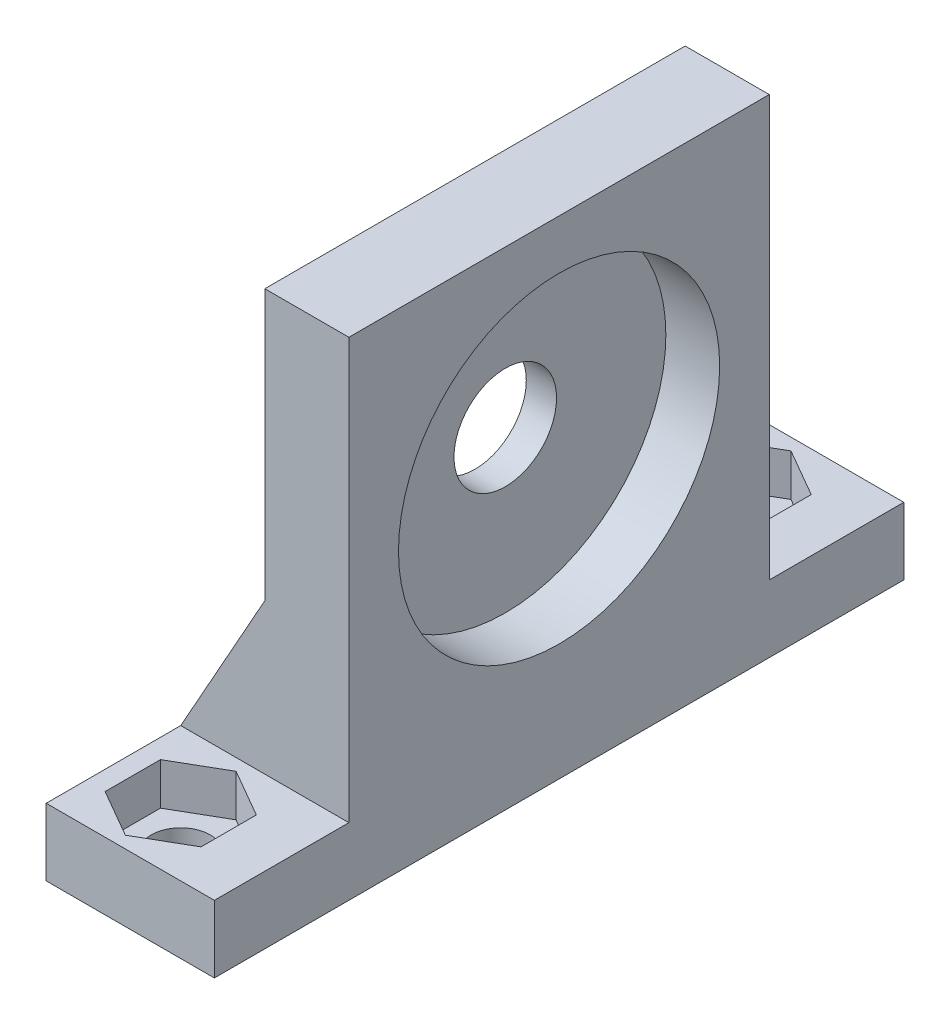
from build123d import *

# Parameters (mm, degrees)
SKETCH1_W           = 20
SKETCH1_H           = 41
SKETCH1_W_2         = 6
SKETCH1_H_2         = 25
SKETCH1_R           = 1.75
BOSS_EXTRUDE1_DEPTH = 4
SKETCH1_3_W         = 6
SKETCH1_3_H         = 25
SKETCH1_3_H_2       = 12.5
BOSS_EXTRUDE2_DEPTH = 29
SKETCH2_R           = 9.55
CUT_EXTRUDE1_DEPTH  = 29
RIB1_REACH          = 50.27
SKETCH3_WALL_W      = 112.866695872
SKETCH3_WALL_H      = 2.95
RIB7_REACH          = 50.27
SKETCH4_WALL_W      = 112.866695872
SKETCH4_WALL_H      = 2.95
CUT_EXTRUDE4_START  = 1.5
SKETCH1_4_R         = 1.75
CUT_EXTRUDE4_DEPTH  = 2.5
SKETCH5_W           = 25
SKETCH5_H           = 25
SKETCH5_R           = 3.05
BOSS_EXTRUDE3_DEPTH = 2
SKETCH6_R           = 9.55
CUT_EXTRUDE5_DEPTH  = 0.2


with BuildPart() as part:
    # Sketch1 → Boss-Extrude1 (new body)
    with BuildSketch(Plane(origin=(0, 0, 0), x_dir=(1, 0, 0), z_dir=(0, 1, 0))):
        with Locations((10, 12.5)):
            Rectangle(SKETCH1_W, SKETCH1_H)
        with Locations((10, 12.5)):
            Rectangle(SKETCH1_W_2, SKETCH1_H_2, mode=Mode.SUBTRACT)
        with Locations(Location((4, -4, 0), (0, 0, 270))):
            Circle(SKETCH1_R, mode=Mode.SUBTRACT)
        with Locations(Location((4, 29, 0), (0, 0, 270))):
            Circle(SKETCH1_R, mode=Mode.SUBTRACT)
        with Locations(Location((16, -4, 0), (0, 0, 270))):
            Circle(SKETCH1_R, mode=Mode.SUBTRACT)
        with Locations(Location((16, 29, 0), (0, 0, 270))):
            Circle(SKETCH1_R, mode=Mode.SUBTRACT)
    extrude(amount=BOSS_EXTRUDE1_DEPTH)

    # Sketch1<3> → Boss-Extrude2 (add)
    with BuildSketch(Plane(origin=(0, 0, 0), x_dir=(1, 0, 0), z_dir=(0, 1, 0))):
        with Locations((10, 12.5)):
            Rectangle(SKETCH1_3_W, SKETCH1_3_H)
        with Locations((10, 18.75)):
            Rectangle(SKETCH1_3_W, SKETCH1_3_H_2)
    extrude(amount=BOSS_EXTRUDE2_DEPTH)

    # Sketch2 → Cut-Extrude1 (cut)
    with BuildSketch(Plane(origin=(13, 0, 0), x_dir=(0, 0, -1), z_dir=(1, 0, 0))):
        with Locations((12.5, 16.5)):
            Circle(SKETCH2_R)
    extrude(amount=-CUT_EXTRUDE1_DEPTH, mode=Mode.SUBTRACT)

    # Sketch3 wall → Rib1 (add, up to next)
    with BuildSketch(Plane(origin=(16.5, 10.25, 0), x_dir=(0.488603368932, -0.87250601595, 0), z_dir=(0.87250601595, 0.488603368932, 0)), mode=Mode.PRIVATE) as rib1_sk1:
        with Locations((0, 1.475)):
            Rectangle(SKETCH3_WALL_W, SKETCH3_WALL_H)
    rib1_tool1 = extrude(rib1_sk1.sketch, amount=-RIB1_REACH, mode=Mode.PRIVATE) - part.part
    rib1 = rib1_tool1.solids().sort_by_distance((16.5, 10.25, 0))[0]
    add(rib1)

    # Sketch4 wall → Rib7 (add, up to next)
    with BuildSketch(Plane(origin=(3.5, 10.25, 0), x_dir=(-0.488603368932, -0.87250601595, 0), z_dir=(0.87250601595, -0.488603368932, 0)), mode=Mode.PRIVATE) as rib7_sk1:
        with Locations((0, 1.475)):
            Rectangle(SKETCH4_WALL_W, SKETCH4_WALL_H)
    rib7_tool1 = extrude(rib7_sk1.sketch, amount=RIB7_REACH, mode=Mode.PRIVATE) - part.part
    rib7 = rib7_tool1.solids().sort_by_distance((3.5, 10.25, 0))[0]
    add(rib7)

    # Mirror1: Rib1, Rib7 across plane
    add(rib1.mirror(Plane.XY.offset(-12.5)))
    add(rib7.mirror(Plane.XY.offset(-12.5)))

    # Sketch1<4> → Cut-Extrude4 (cut)
    # profile 1 of 4: a face of its own
    with BuildSketch(Plane(origin=(0, 0, 0), x_dir=(1, 0, 0), z_dir=(0, 1, 0)).offset(CUT_EXTRUDE4_START)):
        Polygon((4, -0.709103466), (6.85, -2.354551733), (6.85, -5.645448267), (4, -7.290896534), (1.15, -5.645448267), (1.15, -2.354551733), align=None)
        with Locations(Location((4, -4, 0), (0, 0, 270))):
            Circle(SKETCH1_4_R, mode=Mode.SUBTRACT)
    # profile 2 of 4: a face of its own
    with BuildSketch(Plane(origin=(0, 0, 0), x_dir=(1, 0, 0), z_dir=(0, 1, 0)).offset(CUT_EXTRUDE4_START)):
        Polygon((1.15, 30.645448267), (1.15, 27.354551733), (4, 25.709103466), (6.85, 27.354551733), (6.85, 30.645448267), (4, 32.290896534), align=None)
        with Locations(Location((4, 29, 0), (0, 0, 270))):
            Circle(SKETCH1_4_R, mode=Mode.SUBTRACT)
    # profile 3 of 4: a face of its own
    with BuildSketch(Plane(origin=(0, 0, 0), x_dir=(1, 0, 0), z_dir=(0, 1, 0)).offset(CUT_EXTRUDE4_START)):
        Polygon((16, 25.709103466), (13.15, 27.354551733), (13.15, 30.645448267), (16, 32.290896534), (18.85, 30.645448267), (18.85, 27.354551733), align=None)
        with Locations(Location((16, 29, 0), (0, 0, 270))):
            Circle(SKETCH1_4_R, mode=Mode.SUBTRACT)
    # profile 4 of 4: a face of its own
    with BuildSketch(Plane(origin=(0, 0, 0), x_dir=(1, 0, 0), z_dir=(0, 1, 0)).offset(CUT_EXTRUDE4_START)):
        Polygon((18.85, -5.645448267), (18.85, -2.354551733), (16, -0.709103466), (13.15, -2.354551733), (13.15, -5.645448267), (16, -7.290896534), align=None)
        with Locations(Location((16, -4, 0), (0, 0, 270))):
            Circle(SKETCH1_4_R, mode=Mode.SUBTRACT)
    extrude(amount=CUT_EXTRUDE4_DEPTH, mode=Mode.SUBTRACT)

    # Sketch5 → Boss-Extrude3 (add)
    with BuildSketch(Plane.ZY.offset(-7)):
        with Locations((-12.5, 16.5)):
            Rectangle(SKETCH5_W, SKETCH5_H)
        with Locations((-12.5, 16.5)):
            Circle(SKETCH5_R, mode=Mode.SUBTRACT)
    extrude(amount=BOSS_EXTRUDE3_DEPTH)

    # SurfaceCut1
    split(bisect_by=Plane(origin=(10, 0, 0), x_dir=(0, 0, -1), z_dir=(1, 0, 0)), keep=Keep.BOTTOM)

    # Sketch6 → Cut-Extrude5 (cut)
    with BuildSketch(Plane(origin=(7, 0, 0), x_dir=(0, 0, -1), z_dir=(1, 0, 0))):
        with Locations((12.5, 16.5)):
            Circle(SKETCH6_R)
    extrude(amount=-CUT_EXTRUDE5_DEPTH, mode=Mode.SUBTRACT)


solid = part.part
